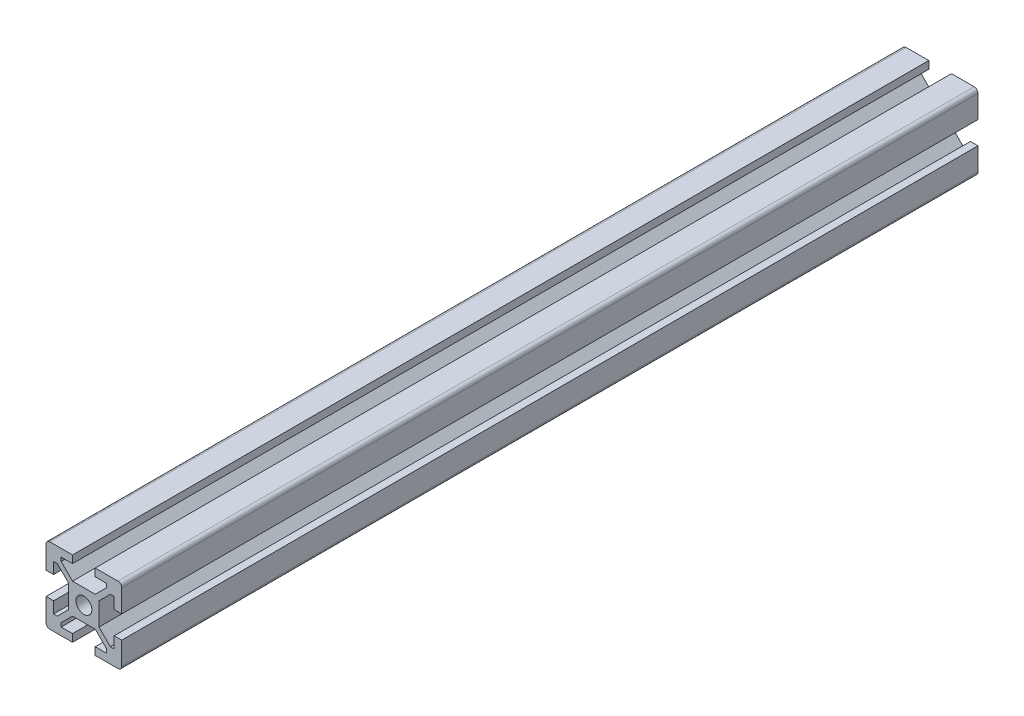
from build123d import *

# Parameters (mm, degrees)
SKETCH1_R           = 2.1
BOSS_EXTRUDE1_DEPTH = 226.15


with BuildPart() as part:
    # Sketch1 → Boss-Extrude1 (new body)
    with BuildSketch(Plane(origin=(0, 0, 0), x_dir=(-1, 0, 0), z_dir=(0, 0, -1))):
        with BuildLine():
            Line((6, -8), (3, -8))
            Line((3, -8), (3, -10))
            Line((3, -10), (9, -10))
            ThreePointArc((9, -10), (9.707106781, -9.707106781), (10, -9))
            Line((10, -9), (10, -3))
            Line((10, -3), (8, -3))
            Line((8, -3), (8, -6))
            Line((8, -6), (7, -6))
            Line((7, -6), (4, -3))
            Line((4, -3), (4, 3))
            Line((4, 3), (7, 6))
            Line((7, 6), (8, 6))
            Line((8, 6), (8, 3))
            Line((8, 3), (10, 3))
            Line((10, 3), (10, 9))
            ThreePointArc((10, 9), (9.707106781, 9.707106781), (9, 10))
            Line((9, 10), (3, 10))
            Line((3, 10), (3, 8))
            Line((3, 8), (6, 8))
            Line((6, 8), (6, 7))
            Line((6, 7), (3, 4))
            Line((3, 4), (-3, 4))
            Line((-3, 4), (-6, 7))
            Line((-6, 7), (-6, 8))
            Line((-6, 8), (-3, 8))
            Line((-3, 8), (-3, 10))
            Line((-3, 10), (-9, 10))
            ThreePointArc((-9, 10), (-9.707106781, 9.707106781), (-10, 9))
            Line((-10, 9), (-10, 3))
            Line((-10, 3), (-8, 3))
            Line((-8, 3), (-8, 6))
            Line((-8, 6), (-7, 6))
            Line((-7, 6), (-4, 3))
            Line((-4, 3), (-4, -3))
            Line((-4, -3), (-7, -6))
            Line((-7, -6), (-8, -6))
            Line((-8, -6), (-8, -3))
            Line((-8, -3), (-10, -3))
            Line((-10, -3), (-10, -9))
            ThreePointArc((-10, -9), (-9.707106781, -9.707106781), (-9, -10))
            Line((-9, -10), (-3, -10))
            Line((-3, -10), (-3, -8))
            Line((-3, -8), (-6, -8))
            Line((-6, -8), (-6, -7))
            Line((-6, -7), (-3, -4))
            Line((-3, -4), (3, -4))
            Line((3, -4), (6, -7))
            Line((6, -7), (6, -8))
        make_face()
        with Locations(Location((0, 0, 0), (0, 0, 180))):
            Circle(SKETCH1_R, mode=Mode.SUBTRACT)
    extrude(amount=-BOSS_EXTRUDE1_DEPTH)


solid = part.part
